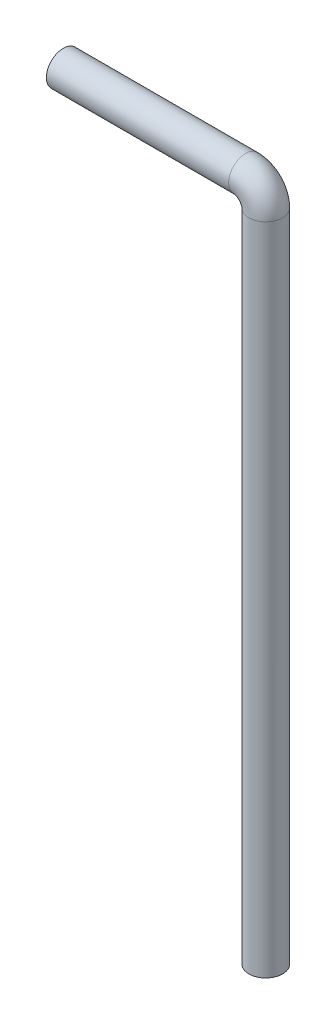
from build123d import *

# Parameters (mm, degrees)
SKETCH_2_R   = 25
SKETCH_2_R_2 = 20.052180854


with BuildPart() as part:
    # 掃出3: sweep along a path in 草圖1
    with BuildLine(Plane.XY) as sweep_3_path:
        Line((0, 0), (270, 0))
        ThreePointArc((270, 0), (291.213203436, -8.786796564), (300, -30))
        Line((300, -30), (300, -1000))
    # 草圖2 → 掃出3 (sweep)
    with BuildSketch(Plane(origin=(0, 0, 0), x_dir=(0, 0, -1), z_dir=(1, 0, 0))):
        Circle(SKETCH_2_R)
        Circle(SKETCH_2_R_2, mode=Mode.SUBTRACT)
    sweep(path=sweep_3_path.line)


solid = part.part
